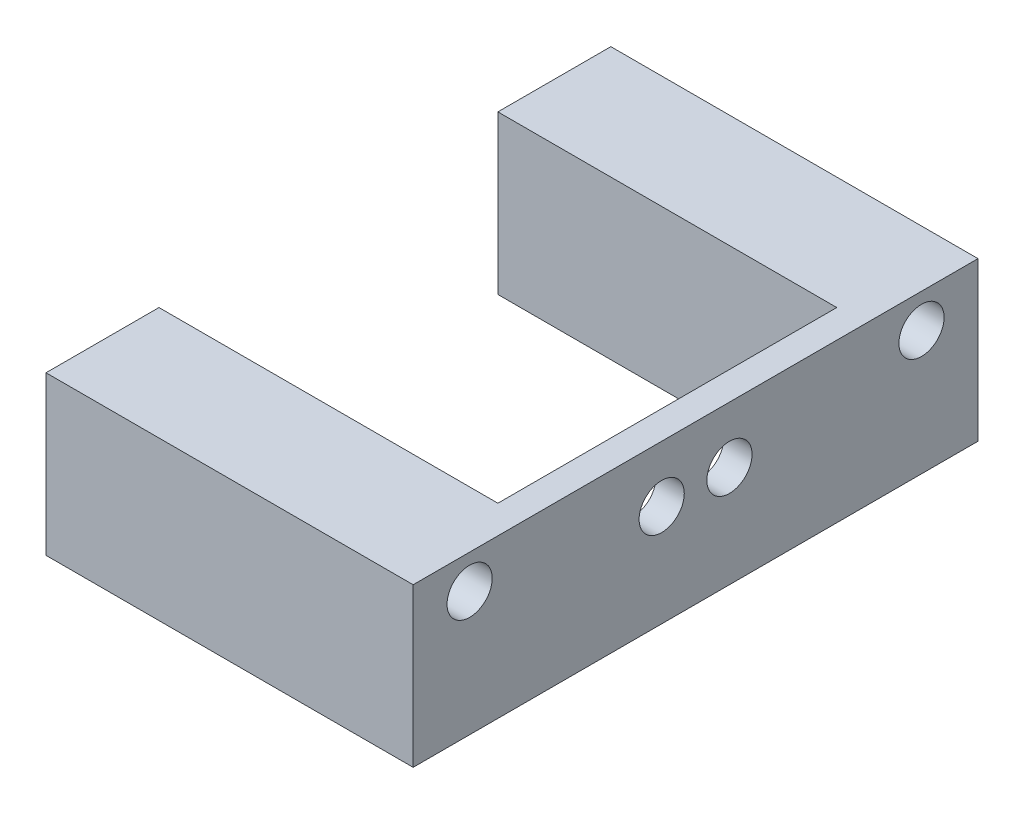
from build123d import *

# Parameters (mm, degrees)
SKETCH1_W           = 6
SKETCH1_H           = 6
SKETCH1_W_2         = 10
SKETCH1_H_2         = 4
SKETCH1_H_3         = 14
SKETCH1_W_3         = 34
BOSS_EXTRUDE1_DEPTH = 5
BOSS_EXTRUDE2_START = 60
SKETCH2_W           = 20
SKETCH2_H           = 28
SKETCH2_R           = 4
BOSS_EXTRUDE2_DEPTH = 60


with BuildPart() as part:
    # Sketch1 → Boss-Extrude1 (new body)
    with BuildSketch(Plane(origin=(0, 0, 0), x_dir=(0, 0, -1), z_dir=(1, 0, 0))):
        with BuildLine():
            ThreePointArc((40, 12), (42.828427125, 10.828427125), (44, 8))
            Line((44, 8), (50, 8))
            Line((50, 8), (50, 14))
            Line((50, 14), (40, 14))
            Line((40, 14), (40, 12))
        make_face()
        with BuildLine():
            Line((6, 14), (6, 8))
            Line((5.999999991, 8), (36, 8))
            ThreePointArc((36, 8), (37.171572875, 10.828427125), (40, 12))
            Line((40, 12), (40, 14))
            Line((40, 14), (6, 14))
        make_face()
        Polygon((0, 14), (0, 8), (5.999999991, 8), (6, 14), align=None)
        with Locations((-3, 11)):
            Rectangle(SKETCH1_W, SKETCH1_H)
        with BuildLine():
            ThreePointArc((-40, 12), (-37.171572875, 10.828427125), (-36, 8))
            Line((-36, 8), (-6.000000002, 8))
            Line((-6, 8), (-6, 14))
            Line((-6, 14), (-40, 14))
            Line((-40, 14), (-40, 12))
        make_face()
        with BuildLine():
            Line((-50, 14), (-50, 8))
            Line((-50, 8), (-44, 8))
            ThreePointArc((-44, 8), (-42.828427125, 10.828427125), (-40, 12))
            Line((-40, 12), (-40, 14))
            Line((-40, 14), (-50, 14))
        make_face()
        with BuildLine():
            Line((-50, 8), (-50, 4))
            Line((-50, 4), (-40, 4))
            ThreePointArc((-40, 4), (-42.828427125, 5.171572875), (-44, 8))
            Line((-44, 8), (-50, 8))
        make_face()
        with Locations((-45, 2)):
            Rectangle(SKETCH1_W_2, SKETCH1_H_2)
        with Locations((-45, -7)):
            Rectangle(SKETCH1_W_2, SKETCH1_H_3)
        with Locations((-23, -7)):
            Rectangle(SKETCH1_W_3, SKETCH1_H_3)
        with BuildLine():
            Line((-40, 4), (-40, 0))
            Line((-40, 0), (-6, 0))
            ThreePointArc((-6, 0), (-8.828427125, 1.171572875), (-10, 4))
            Line((-10, 4), (-40, 4))
        make_face()
        with BuildLine():
            ThreePointArc((-36, 8), (-37.171572875, 5.171572875), (-40, 4))
            Line((-40, 4), (-10, 4))
            ThreePointArc((-10, 4), (-8.828427126, 6.828427124), (-6.000000002, 8))
            Line((-6.000000002, 8), (-36, 8))
        make_face()
        with Locations((-3, -7)):
            Rectangle(SKETCH1_W, SKETCH1_H_3)
        with BuildLine():
            Line((0, 8), (0, 4))
            Line((0, 4), (2, 4))
            ThreePointArc((2, 4), (3.171572872, 6.828427122), (5.999999991, 8))
            Line((5.999999991, 8), (0, 8))
        make_face()
        with BuildLine():
            ThreePointArc((-6.000000002, 8), (-3.171572876, 6.828427126), (-2, 4))
            Line((-2, 4), (0, 4))
            Line((0, 4), (0, 8))
            Line((0, 8), (-6.000000002, 8))
        make_face()
        with Locations((3, -7)):
            Rectangle(SKETCH1_W, SKETCH1_H_3)
        with BuildLine():
            Line((0, 4), (0, 0))
            Line((0, 0), (6, 0))
            ThreePointArc((6, 0), (3.171572875, 1.171572875), (2, 4))
            Line((2, 4), (0, 4))
        make_face()
        with BuildLine():
            ThreePointArc((-2, 4), (-3.171572875, 1.171572875), (-6, 0))
            Line((-6, 0), (0, 0))
            Line((0, 0), (0, 4))
            Line((0, 4), (-2, 4))
        make_face()
        with BuildLine():
            ThreePointArc((10, 4), (8.828427125, 1.171572875), (6, 0))
            Line((6, 0), (40, 0))
            Line((40, 0), (40, 4))
            Line((39.999999991, 4), (10, 4))
        make_face()
        with BuildLine():
            ThreePointArc((5.999999991, 8), (8.828427122, 6.828427128), (10, 4))
            Line((10, 4), (39.999999991, 4))
            ThreePointArc((39.999999991, 4), (37.171572872, 5.171572878), (36, 8))
            Line((36, 8), (5.999999991, 8))
        make_face()
        with Locations((23, -7)):
            Rectangle(SKETCH1_W_3, SKETCH1_H_3)
        with Locations((45, -7)):
            Rectangle(SKETCH1_W_2, SKETCH1_H_3)
        with Locations((45, 2)):
            Rectangle(SKETCH1_W_2, SKETCH1_H_2)
        with BuildLine():
            ThreePointArc((44, 8), (42.828427122, 5.171572872), (39.999999991, 4))
            Line((39.999999991, 4), (50, 4))
            Line((50, 4), (50, 8))
            Line((50, 8), (44, 8))
        make_face()
    extrude(amount=BOSS_EXTRUDE1_DEPTH)

    # Sketch2 → Boss-Extrude2 (add)
    # profile 1 of 2: a face of its own
    with BuildSketch(Plane.ZY.offset(BOSS_EXTRUDE2_START)):
        with Locations((-40, 0)):
            Rectangle(SKETCH2_W, SKETCH2_H)
        with Locations((-40, 8)):
            Circle(SKETCH2_R, mode=Mode.SUBTRACT)
    # profile 2 of 2: a face of its own
    with BuildSketch(Plane.ZY.offset(BOSS_EXTRUDE2_START)):
        with Locations((40, 0)):
            Rectangle(SKETCH2_W, SKETCH2_H)
        with Locations((40, 8)):
            Circle(SKETCH2_R, mode=Mode.SUBTRACT)
    extrude(amount=-BOSS_EXTRUDE2_DEPTH)


solid = part.part
